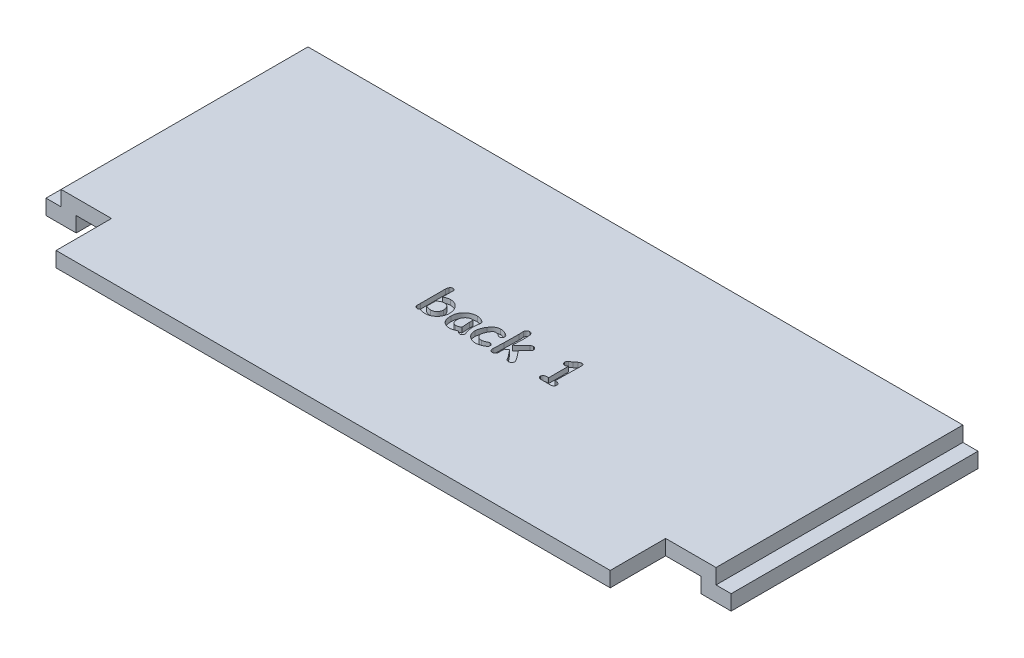
from build123d import *

# Parameters (mm, degrees)
SKETCH_1_W          = 110
SKETCH_1_H          = 3
EXTRUDE_1_DEPTH     = 11
SKETCH_2_W          = 136
SKETCH_2_H          = 3
EXTRUDE_2_DEPTH     = 14
SKETCH_3_W          = 136
SKETCH_3_H          = 6
EXTRUDE_3_DEPTH     = 3
SKETCH_4_W          = 130
SKETCH_4_H          = 3
EXTRUDE_4_DEPTH     = 32
SKETCH_10_W         = 6
SKETCH_10_H         = 14
EXTRUDE_6_DEPTH     = 3
SKETCH_11_W         = 3
SKETCH_11_H         = 17
CUT_EXTRUDE_2_DEPTH = 3
SKETCH_12_W         = 124
SKETCH_12_H         = 35.16497992
CUT_EXTRUDE_3_DEPTH = 3
CUT_EXTRUDE_4_DEPTH = 1


with BuildPart() as part:
    # 草圖1 → 填料-伸長1 (new body)
    with BuildSketch(Plane.XY):
        with Locations((-47.028571429, 0.492857143)):
            Rectangle(SKETCH_1_W, SKETCH_1_H)
    extrude(amount=EXTRUDE_1_DEPTH)

    # 草圖2 → 填料-伸長2 (add)
    with BuildSketch(Plane(origin=(0, 0, 0), x_dir=(-1, 0, 0), z_dir=(0, 0, -1))):
        with Locations((47.028571429, 0.492857143)):
            Rectangle(SKETCH_2_W, SKETCH_2_H)
    extrude(amount=EXTRUDE_2_DEPTH)

    # 草圖3 → 填料-伸長3 (add)
    with BuildSketch(Plane(origin=(0, 0, -14), x_dir=(-1, 0, 0), z_dir=(0, 0, -1))):
        with Locations((47.028571429, -1.007142857)):
            Rectangle(SKETCH_3_W, SKETCH_3_H)
    extrude(amount=EXTRUDE_3_DEPTH)

    # 草圖4 → 填料-伸長4 (add)
    with BuildSketch(Plane(origin=(0, 0, -17), x_dir=(-1, 0, 0), z_dir=(0, 0, -1))):
        Polygon((-20.971428571, -4.007142857), (115.028571429, -4.007142857), (115.028571429, -1.007142857), (112.028571429, -1.007142857), (-17.971428571, -1.007142857), (-20.971428571, -1.007142857), align=None)
        with Locations((47.028571429, 0.492857143)):
            Rectangle(SKETCH_4_W, SKETCH_4_H)
    extrude(amount=EXTRUDE_4_DEPTH)

    # 草圖10 → 填料-伸長6 (add)
    with BuildSketch(Plane.XZ.offset(1.007142857)):
        with Locations((17.971428571, -7)):
            Rectangle(SKETCH_10_W, SKETCH_10_H)
        with Locations((-112.028571429, -7)):
            Rectangle(SKETCH_10_W, SKETCH_10_H)
    extrude(amount=EXTRUDE_6_DEPTH)

    # 草圖11 → 除料-伸長2 (cut)
    with BuildSketch(Plane(origin=(0, 1.992857143, 0), x_dir=(1, 0, 0), z_dir=(0, 1, 0))):
        with Locations((19.471428571, 8.5)):
            Rectangle(SKETCH_11_W, SKETCH_11_H)
        with Locations((-113.528571429, 8.5)):
            Rectangle(SKETCH_11_W, SKETCH_11_H)
    extrude(amount=-CUT_EXTRUDE_2_DEPTH, mode=Mode.SUBTRACT)

    # 草圖12 → 除料-伸長3 (cut)
    with BuildSketch(Plane.XZ.offset(4.007142857)):
        with Locations((-47.028571429, -31.58248996)):
            Rectangle(SKETCH_12_W, SKETCH_12_H)
    extrude(amount=-CUT_EXTRUDE_3_DEPTH, mode=Mode.SUBTRACT)

    # 草圖13 → 除料-伸長4 (cut)
    # profile 1 of 5: a face of its own
    with BuildSketch(Plane(origin=(0, 1.992857143, 0), x_dir=(1, 0, 0), z_dir=(0, 1, 0))):
        with BuildLine():
            add(Edge.make_bspline(
                [(-54.627504078, 14.779163289), (-54.730011786, 14.782196796), (-54.933438462, 14.788216796), (-55.234530646, 14.835959796), (-55.528768994, 14.911104097), (-55.715946121, 14.987694926), (-55.80967424, 15.026047444)],
                knots=[0, 0, 0, 0, 1.011051074, 2.006432122, 3.001729703, 4, 4, 4, 4], degree=3))
            add(Edge.make_bspline(
                [(-55.80967424, 15.026047444), (-55.837443409, 15.000782814), (-55.891964228, 14.951179301), (-55.990120587, 14.899833319), (-56.096887174, 14.86862703), (-56.171290167, 14.864749784), (-56.209391443, 14.862764273)],
                knots=[0, 0, 0, 0, 1.012867807, 1.988622055, 2.969986786, 4, 4, 4, 4], degree=3))
            add(Edge.make_bspline(
                [(-56.209391443, 14.862764273), (-56.248304907, 14.864900742), (-56.324190104, 14.869067073), (-56.433967072, 14.898024094), (-56.533184481, 14.949614537), (-56.623142226, 15.016472937), (-56.697846378, 15.099830557), (-56.752135306, 15.195621847), (-56.786898101, 15.301508337), (-56.790260236, 15.375852357), (-56.791985799, 15.41400826)],
                knots=[0, 0, 0, 0, 1.045861851, 2.039536594, 3.023583619, 4.034817863, 5.037891374, 6.007635444, 6.977450141, 8, 8, 8, 8], degree=3))
            add(Edge.make_bspline(
                [(-56.791985799, 15.41400826), (-56.791600254, 15.433603571), (-56.790726172, 15.478028755), (-56.788019166, 15.551182492), (-56.784036056, 15.638701522), (-56.77871026, 15.735339787), (-56.774576716, 15.832490843), (-56.767616764, 15.919884394), (-56.767502197, 15.993129143), (-56.766366514, 16.037099237), (-56.765860492, 16.056690823)],
                knots=[0, 0, 0, 0, 0.731206305, 1.657742177, 2.731020434, 3.999796929, 5.268573424, 6.358927633, 7.268793695, 8, 8, 8, 8], degree=3))
            Line((-56.765860492, 16.056690823), (-56.765860492, 21.013967909))
            add(Edge.make_bspline(
                [(-56.765860492, 21.013967909), (-56.764123656, 21.06547242), (-56.760744079, 21.165691116), (-56.733779842, 21.31149316), (-56.69018187, 21.448615125), (-56.646473855, 21.532652404), (-56.624783832, 21.574355753)],
                knots=[0, 0, 0, 0, 1.05727785, 2.057276263, 3.035926844, 4, 4, 4, 4], degree=3))
            add(Edge.make_bspline(
                [(-56.624783832, 21.574355753), (-56.609667828, 21.599120298), (-56.580509053, 21.646891112), (-56.528729708, 21.710543575), (-56.472234945, 21.764697555), (-56.41083668, 21.809344024), (-56.344848936, 21.843893915), (-56.274241416, 21.867416391), (-56.199117605, 21.882185711), (-56.147196625, 21.884209085), (-56.120565398, 21.885246912)],
                knots=[0, 0, 0, 0, 1.115704314, 2.152193933, 3.147912463, 4.120081468, 5.06455433, 6.002611774, 6.975502777, 8, 8, 8, 8], degree=3))
            add(Edge.make_bspline(
                [(-56.120565398, 21.885246912), (-56.083401008, 21.883990212), (-56.01344459, 21.881624662), (-55.915396963, 21.857548169), (-55.831360492, 21.818773995), (-55.761744488, 21.76223584), (-55.710626278, 21.687798388), (-55.673515192, 21.598950963), (-55.651918387, 21.494811697), (-55.649154938, 21.420319856), (-55.647697333, 21.381028478)],
                knots=[0, 0, 0, 0, 1.124217311, 2.116171334, 3.036773383, 3.908427477, 4.797970107, 5.743844808, 6.809971068, 8, 8, 8, 8], degree=3))
            add(Edge.make_bspline(
                [(-55.647697333, 21.381028478), (-55.648728843, 21.356622438), (-55.651277673, 21.296315851), (-55.663372518, 21.200763857), (-55.675467363, 21.105211863), (-55.678016192, 21.044905276), (-55.679047702, 21.020499235)],
                knots=[0, 0, 0, 0, 0.809398822, 2, 3.190601178, 4, 4, 4, 4], degree=3))
            Line((-55.679047702, 21.020499235), (-55.679047702, 19.349785825))
            add(Edge.make_bspline(
                [(-55.679047702, 19.349785825), (-55.624836559, 19.37850178), (-55.518811889, 19.434663659), (-55.359551153, 19.510127916), (-55.202293553, 19.570751111), (-55.049263096, 19.622835936), (-54.898491166, 19.661749746), (-54.751172082, 19.690851624), (-54.606181914, 19.708825914), (-54.510424711, 19.71069432), (-54.462914641, 19.711621333)],
                knots=[0, 0, 0, 0, 1.148291504, 2.245797059, 3.296170274, 4.301333296, 5.269981604, 6.20825412, 7.111022791, 8, 8, 8, 8], degree=3))
            add(Edge.make_bspline(
                [(-54.462914641, 19.711621333), (-54.377447098, 19.709465036), (-54.210108789, 19.705243187), (-53.965753786, 19.669170544), (-53.734113963, 19.610290775), (-53.514354226, 19.528322721), (-53.308434219, 19.419528459), (-53.11343988, 19.289969465), (-52.932202223, 19.135160068), (-52.824499848, 19.0165999), (-52.769994719, 18.956599948)],
                knots=[0, 0, 0, 0, 1.069904979, 2.094784584, 3.085377722, 4.058664938, 5.024515174, 5.995462442, 6.985560174, 8, 8, 8, 8], degree=3))
            add(Edge.make_bspline(
                [(-52.769994719, 18.956599948), (-52.721841815, 18.896913822), (-52.626187687, 18.778349336), (-52.503347175, 18.586601889), (-52.399867223, 18.385643511), (-52.314004477, 18.17567298), (-52.249169249, 17.955331784), (-52.202386887, 17.725927391), (-52.172494402, 17.487404252), (-52.169385208, 17.325164113), (-52.167806383, 17.24277978)],
                knots=[0, 0, 0, 0, 0.991022406, 1.968632743, 2.938070816, 3.910365585, 4.89720526, 5.903084783, 6.935202082, 8, 8, 8, 8], degree=3))
            add(Edge.make_bspline(
                [(-52.167806383, 17.24277978), (-52.169674144, 17.159075261), (-52.173356353, 16.994055416), (-52.206690191, 16.751583448), (-52.26212134, 16.519147803), (-52.336982062, 16.295503819), (-52.438242856, 16.083656658), (-52.556662144, 15.879327016), (-52.70009099, 15.686528145), (-52.809803293, 15.568047629), (-52.865352091, 15.508059366)],
                knots=[0, 0, 0, 0, 1.045981923, 2.062108186, 3.052288653, 4.029988146, 5.003983643, 5.982319294, 6.978421401, 8, 8, 8, 8], degree=3))
            add(Edge.make_bspline(
                [(-52.865352091, 15.508059366), (-52.925066102, 15.449591339), (-53.043021323, 15.334097352), (-53.239647721, 15.187542112), (-53.444013692, 15.059701279), (-53.661070614, 14.959018693), (-53.886713707, 14.875722996), (-54.124692171, 14.821097983), (-54.372594686, 14.785829872), (-54.541601298, 14.781409883), (-54.627504078, 14.779163289)],
                knots=[0, 0, 0, 0, 1.021703276, 2.018207041, 2.994298099, 3.966848069, 4.941133761, 5.932494983, 6.949127326, 8, 8, 8, 8], degree=3))
        make_face()
        with BuildLine():
            add(Edge.make_bspline(
                [(-54.464220907, 18.54120756), (-54.50439418, 18.5396531), (-54.588493017, 18.536398989), (-54.717938384, 18.509497806), (-54.856182144, 18.46826704), (-55.003330466, 18.411922263), (-55.159783591, 18.339103727), (-55.325060579, 18.249848141), (-55.500321029, 18.145316026), (-55.61798565, 18.067119229), (-55.679047702, 18.026539003)],
                knots=[0, 0, 0, 0, 0.721005008, 1.509353813, 2.36553554, 3.311060063, 4.336278061, 5.462876802, 6.683359988, 8, 8, 8, 8], degree=3))
            add(Edge.make_bspline(
                [(-55.679047702, 18.026539003), (-55.679586142, 17.987351614), (-55.680806562, 17.89852993), (-55.680188977, 17.749174407), (-55.680411071, 17.568475591), (-55.680331682, 17.355989348), (-55.680376174, 17.112588667), (-55.680280281, 16.837402221), (-55.680669979, 16.530863706), (-55.679605698, 16.315766553), (-55.679047702, 16.202992544)],
                knots=[0, 0, 0, 0, 0.515788382, 1.169080008, 1.965637341, 2.893999125, 3.965626617, 5.169058559, 6.515756208, 8, 8, 8, 8], degree=3))
            add(Edge.make_bspline(
                [(-55.679047702, 16.202992544), (-55.629047166, 16.183217752), (-55.531655177, 16.144700039), (-55.387708907, 16.091267891), (-55.248312929, 16.048732034), (-55.114439559, 16.013506154), (-54.98666181, 15.983705881), (-54.863930411, 15.964671042), (-54.746644255, 15.951915245), (-54.67020702, 15.95034632), (-54.63272914, 15.949577062)],
                knots=[0, 0, 0, 0, 1.191481398, 2.320789979, 3.401144957, 4.419169971, 5.388239374, 6.306657422, 7.169738545, 8, 8, 8, 8], degree=3))
            add(Edge.make_bspline(
                [(-54.63272914, 15.949577062), (-54.586501345, 15.950274334), (-54.49626843, 15.951635353), (-54.364346792, 15.971259815), (-54.238561108, 15.999966162), (-54.117751777, 16.037975468), (-54.004890784, 16.091885448), (-53.89701999, 16.154129806), (-53.795955233, 16.229236691), (-53.702406321, 16.315531428), (-53.616843525, 16.409774389), (-53.542042496, 16.510848277), (-53.478009659, 16.617645851), (-53.428274463, 16.731416446), (-53.386328997, 16.850267775), (-53.358421376, 16.975679714), (-53.340784236, 17.106856149), (-53.339083799, 17.196131208), (-53.338220156, 17.241473515)],
                knots=[0, 0, 0, 0, 1.082436338, 2.112828187, 3.117845096, 4.105302121, 5.073161415, 6.042740585, 7.020341339, 8.017034983, 9.021274517, 9.998875271, 10.959661725, 11.932564502, 12.903914104, 13.908931013, 14.937957669, 16, 16, 16, 16], degree=3))
            add(Edge.make_bspline(
                [(-53.338220156, 17.241473515), (-53.339443856, 17.286779121), (-53.341849185, 17.375832739), (-53.354233063, 17.506605386), (-53.378275797, 17.631418037), (-53.410577961, 17.750387593), (-53.452495098, 17.863218705), (-53.503752674, 17.970105788), (-53.564945078, 18.070539142), (-53.61241859, 18.132737477), (-53.636048661, 18.163696867)],
                knots=[0, 0, 0, 0, 1.100015173, 2.162212091, 3.184155695, 4.181593202, 5.15143388, 6.10160926, 7.055070829, 8, 8, 8, 8], degree=3))
            add(Edge.make_bspline(
                [(-53.636048661, 18.163696867), (-53.662298885, 18.19403961), (-53.713828139, 18.253602487), (-53.803170428, 18.329465613), (-53.897231417, 18.395396239), (-53.99827614, 18.449718864), (-54.106392638, 18.489319106), (-54.219736285, 18.520693115), (-54.340103916, 18.53680292), (-54.422381981, 18.539722788), (-54.464220907, 18.54120756)],
                knots=[0, 0, 0, 0, 1.020672895, 2.003583353, 2.975859956, 3.943443527, 4.915783394, 5.903189464, 6.933758352, 8, 8, 8, 8], degree=3))
        make_face(mode=Mode.SUBTRACT)
    # profile 2 of 5: a face of its own
    with BuildSketch(Plane(origin=(0, 1.992857143, 0), x_dir=(1, 0, 0), z_dir=(0, 1, 0))):
        with BuildLine():
            add(Edge.make_bspline(
                [(-47.648128196, 14.695562305), (-47.666104091, 14.697086433), (-47.705006405, 14.700384857), (-47.765813302, 14.720792175), (-47.834145456, 14.751089084), (-47.909747348, 14.794601278), (-47.991341946, 14.851828309), (-48.082262286, 14.918389292), (-48.180002559, 14.998071941), (-48.245799902, 15.057521622), (-48.280360636, 15.088748182)],
                knots=[0, 0, 0, 0, 0.570994106, 1.235709944, 2.021750519, 2.944254947, 3.998712181, 5.184863288, 6.52132032, 8, 8, 8, 8], degree=3))
            add(Edge.make_bspline(
                [(-48.280360636, 15.088748182), (-48.344636904, 15.057916146), (-48.468508322, 14.998497512), (-48.649504787, 14.91861006), (-48.819295159, 14.851892623), (-48.976465329, 14.794783729), (-49.122808261, 14.752027213), (-49.257212858, 14.719253101), (-49.380569515, 14.700369889), (-49.459430796, 14.69709937), (-49.496493698, 14.695562305)],
                knots=[0, 0, 0, 0, 1.329209789, 2.561615814, 3.687824394, 4.730391586, 5.678350345, 6.529086513, 7.308706092, 8, 8, 8, 8], degree=3))
            add(Edge.make_bspline(
                [(-49.496493698, 14.695562305), (-49.580601319, 14.697322288), (-49.744015004, 14.700741779), (-49.981326617, 14.727019137), (-50.20250138, 14.770299528), (-50.406925973, 14.834081281), (-50.596147533, 14.912702041), (-50.768355862, 15.011910116), (-50.92546338, 15.12691699), (-51.064962669, 15.261857232), (-51.188161313, 15.414079715), (-51.294875355, 15.584169622), (-51.383191779, 15.772333024), (-51.456463121, 15.977501543), (-51.513793997, 16.200024578), (-51.553294017, 16.44046489), (-51.578829964, 16.697950071), (-51.581318242, 16.875654768), (-51.582599496, 16.967157787)],
                knots=[0, 0, 0, 0, 1.14139066, 2.217621297, 3.236433233, 4.19541141, 5.119669229, 6.01179398, 6.886502125, 7.755903195, 8.638304332, 9.538535932, 10.474361038, 11.453933755, 12.49175023, 13.588698518, 14.758381922, 16, 16, 16, 16], degree=3))
            add(Edge.make_bspline(
                [(-51.582599496, 16.967157787), (-51.580514118, 17.054373126), (-51.576407647, 17.226115291), (-51.538658447, 17.478748852), (-51.477009561, 17.721493162), (-51.391967348, 17.955579508), (-51.28156015, 18.179506293), (-51.14721952, 18.393955535), (-50.98849425, 18.598435594), (-50.806263996, 18.789694357), (-50.608715275, 18.96585822), (-50.399386072, 19.121213699), (-50.179222319, 19.25115498), (-49.950831893, 19.358958784), (-49.711524742, 19.441608944), (-49.463665725, 19.501749362), (-49.20538955, 19.537885599), (-49.030272034, 19.54221864), (-48.941330915, 19.544419365)],
                knots=[0, 0, 0, 0, 1.020575022, 2.009689629, 2.982726031, 3.948726453, 4.919931715, 5.900139181, 6.906560586, 7.945094392, 8.988633149, 10.002091967, 10.991758148, 11.976937157, 12.953918173, 13.950466294, 14.959054324, 16, 16, 16, 16], degree=3))
            add(Edge.make_bspline(
                [(-48.941330915, 19.544419365), (-48.869285737, 19.541475166), (-48.718289204, 19.535304539), (-48.485026664, 19.487364357), (-48.235627312, 19.412467221), (-48.067772217, 19.343881815), (-47.979919601, 19.307985333)],
                knots=[0, 0, 0, 0, 0.867176249, 1.817479126, 2.857704205, 4, 4, 4, 4], degree=3))
            add(Edge.make_bspline(
                [(-47.979919601, 19.307985333), (-47.927637146, 19.28498816), (-47.828559201, 19.241407333), (-47.69450902, 19.16468247), (-47.579976284, 19.086603867), (-47.484765164, 19.00645378), (-47.411070381, 18.921984651), (-47.358768476, 18.834041022), (-47.32506018, 18.742575827), (-47.320971132, 18.679505913), (-47.318949323, 18.64832132)],
                knots=[0, 0, 0, 0, 1.389672819, 2.63350156, 3.753796321, 4.761008421, 5.655539949, 6.468188948, 7.242603956, 8, 8, 8, 8], degree=3))
            add(Edge.make_bspline(
                [(-47.318949323, 18.64832132), (-47.319751503, 18.622944901), (-47.321320057, 18.573324745), (-47.339654526, 18.501707958), (-47.366360137, 18.434162389), (-47.393093597, 18.394066634), (-47.406469103, 18.374005592)],
                knots=[0, 0, 0, 0, 1.037888639, 2.029450906, 3.014078523, 4, 4, 4, 4], degree=3))
            add(Edge.make_bspline(
                [(-47.406469103, 18.374005592), (-47.412857586, 18.343144099), (-47.426387384, 18.277784339), (-47.441586029, 18.17309146), (-47.454084723, 18.057124877), (-47.466196717, 17.93045678), (-47.475121162, 17.792802445), (-47.481538274, 17.643854221), (-47.485456502, 17.483589062), (-47.485914902, 17.372973163), (-47.48615129, 17.315930641)],
                knots=[0, 0, 0, 0, 0.711555323, 1.50696163, 2.387567636, 3.345424226, 4.380136604, 5.502128072, 6.711894799, 8, 8, 8, 8], degree=3))
            add(Edge.make_bspline(
                [(-47.48615129, 17.315930641), (-47.486040947, 17.248871488), (-47.485828103, 17.119520079), (-47.480290894, 16.933133777), (-47.472438806, 16.761125385), (-47.462806101, 16.603785385), (-47.448018296, 16.460973995), (-47.431736611, 16.332718906), (-47.411154583, 16.218905654), (-47.393736421, 16.148490969), (-47.385568857, 16.115472764)],
                knots=[0, 0, 0, 0, 1.332734974, 2.570732545, 3.705587252, 4.755000234, 5.703070943, 6.558586414, 7.32410562, 8, 8, 8, 8], degree=3))
            add(Edge.make_bspline(
                [(-47.385568857, 16.115472764), (-47.383873346, 16.110231154), (-47.37916562, 16.095677385), (-47.368135202, 16.068613663), (-47.354380214, 16.029036133), (-47.334151481, 15.978493548), (-47.311221868, 15.91540696), (-47.281923281, 15.841329006), (-47.249744049, 15.754766757), (-47.225861141, 15.693513854), (-47.213141828, 15.660892415)],
                knots=[0, 0, 0, 0, 0.271870762, 0.754871954, 1.441648389, 2.339748258, 3.441579783, 4.754781702, 6.27169509, 8, 8, 8, 8], degree=3))
            add(Edge.make_bspline(
                [(-47.213141828, 15.660892415), (-47.201866879, 15.631266274), (-47.180640189, 15.57549086), (-47.150003388, 15.497065159), (-47.125307558, 15.428200082), (-47.105795787, 15.369234812), (-47.090252365, 15.320861676), (-47.077731035, 15.282883124), (-47.070985051, 15.254401819), (-47.068935923, 15.238546574), (-47.068146371, 15.232437373)],
                knots=[0, 0, 0, 0, 1.679572054, 3.162032608, 4.460976333, 5.555315553, 6.45270337, 7.153232445, 7.673731082, 8, 8, 8, 8], degree=3))
            add(Edge.make_bspline(
                [(-47.068146371, 15.232437373), (-47.069888876, 15.19515289), (-47.073283697, 15.122513689), (-47.107896728, 15.018869332), (-47.163784931, 14.925420299), (-47.241464616, 14.845607707), (-47.331671358, 14.780228716), (-47.430341823, 14.729800333), (-47.53717138, 14.700522661), (-47.610945936, 14.697224549), (-47.648128196, 14.695562305)],
                knots=[0, 0, 0, 0, 1.016199693, 1.979803046, 2.951459139, 3.970165221, 5.001037038, 5.985800237, 6.984846462, 8, 8, 8, 8], degree=3))
        make_face()
        with BuildLine():
            add(Edge.make_bspline(
                [(-48.656565063, 17.662090964), (-48.656565063, 17.711293627), (-48.656565063, 17.8166657), (-48.656565063, 17.985173933), (-48.656565063, 18.173711568), (-48.656565063, 18.306079793), (-48.656565063, 18.375311858)],
                knots=[0, 0, 0, 0, 0.827838828, 1.772893773, 2.835164835, 4, 4, 4, 4], degree=3))
            add(Edge.make_bspline(
                [(-48.656565063, 18.375311858), (-48.682403327, 18.38860662), (-48.730071532, 18.413133713), (-48.79973629, 18.437518445), (-48.859625751, 18.453619546), (-48.896840866, 18.456353431), (-48.913899342, 18.457606576)],
                knots=[0, 0, 0, 0, 1.278646011, 2.358934062, 3.247776538, 4, 4, 4, 4], degree=3))
            add(Edge.make_bspline(
                [(-48.913899342, 18.457606576), (-48.960600183, 18.456654279), (-49.05281457, 18.454773897), (-49.188259112, 18.430630237), (-49.31986135, 18.396650278), (-49.44571771, 18.34416527), (-49.568059615, 18.280053819), (-49.686428778, 18.201511984), (-49.798298445, 18.106196835), (-49.905741428, 18.000494161), (-50.004327556, 17.885282473), (-50.090652996, 17.763588315), (-50.164504683, 17.637462305), (-50.225079481, 17.506840355), (-50.270245994, 17.371136362), (-50.305243701, 17.232069049), (-50.324839706, 17.08746072), (-50.327325019, 16.989419834), (-50.328584739, 16.939726214)],
                knots=[0, 0, 0, 0, 0.975911698, 1.927012402, 2.870709727, 3.814758816, 4.772469297, 5.757945252, 6.779810011, 7.842802078, 8.909068736, 9.948051348, 10.960613622, 11.963456129, 12.954559341, 13.948923457, 14.960378456, 16, 16, 16, 16], degree=3))
            add(Edge.make_bspline(
                [(-50.328584739, 16.939726214), (-50.328379551, 16.893107645), (-50.327982018, 16.802788755), (-50.316519044, 16.67208719), (-50.301730222, 16.550246371), (-50.279325914, 16.437223307), (-50.251167742, 16.332618959), (-50.215492127, 16.237226308), (-50.175771772, 16.149626654), (-50.126712556, 16.072862594), (-50.073300728, 16.003272395), (-50.011315465, 15.944913215), (-49.944223331, 15.894154345), (-49.869941889, 15.853906472), (-49.790584236, 15.820545437), (-49.703745764, 15.799104936), (-49.611557342, 15.783766593), (-49.547506991, 15.782845641), (-49.514781413, 15.782375094)],
                knots=[0, 0, 0, 0, 1.390925397, 2.694781069, 3.913525777, 5.052899351, 6.131261505, 7.142861553, 8.090576077, 8.995714656, 9.856369476, 10.702075908, 11.528691265, 12.360602882, 13.21742184, 14.090644474, 15.024443049, 16, 16, 16, 16], degree=3))
            add(Edge.make_bspline(
                [(-49.514781413, 15.782375094), (-49.471178429, 15.783235228), (-49.384936498, 15.784936477), (-49.257791805, 15.802845755), (-49.134531322, 15.830117854), (-49.014545204, 15.86814343), (-48.898437735, 15.918045385), (-48.785728897, 15.978397722), (-48.676499577, 16.049266352), (-48.607815837, 16.103585252), (-48.57296408, 16.131147949)],
                knots=[0, 0, 0, 0, 1.019791921, 2.017036824, 2.998486841, 3.971703296, 4.957797258, 5.951600318, 6.960593445, 8, 8, 8, 8], degree=3))
            add(Edge.make_bspline(
                [(-48.57296408, 16.131147949), (-48.579588645, 16.213870847), (-48.592381944, 16.373624548), (-48.609411155, 16.60527012), (-48.623854188, 16.8208047), (-48.635617779, 17.020233883), (-48.644906223, 17.203548753), (-48.651466213, 17.370759424), (-48.65567675, 17.521863445), (-48.656280943, 17.617240219), (-48.656565063, 17.662090964)],
                knots=[0, 0, 0, 0, 1.298731023, 2.508097406, 3.634940138, 4.679318611, 5.63450171, 6.507387574, 7.298101854, 8, 8, 8, 8], degree=3))
        make_face(mode=Mode.SUBTRACT)
    # profile 3 of 5: a face of its own
    with BuildSketch(Plane(origin=(0, 1.992857143, 0), x_dir=(1, 0, 0), z_dir=(0, 1, 0))):
        with BuildLine():
            add(Edge.make_bspline(
                [(-44.368095848, 14.695562305), (-44.446095658, 14.697488643), (-44.599010542, 14.701265136), (-44.823756071, 14.725933149), (-45.038694465, 14.769264483), (-45.244602592, 14.829403921), (-45.441182856, 14.906300485), (-45.627554648, 15.001344211), (-45.805185815, 15.111660309), (-45.913809123, 15.199064554), (-45.968270928, 15.242887496)],
                knots=[0, 0, 0, 0, 1.083691855, 2.124525873, 3.136533083, 4.126235372, 5.101334756, 6.064482253, 7.02956565, 8, 8, 8, 8], degree=3))
            add(Edge.make_bspline(
                [(-45.968270928, 15.242887496), (-46.022574168, 15.291782649), (-46.129714851, 15.388253137), (-46.268368276, 15.55199933), (-46.386988685, 15.725923998), (-46.482802279, 15.912703092), (-46.559646291, 16.109752439), (-46.610301774, 16.319456839), (-46.645081087, 16.539285055), (-46.648427842, 16.690085917), (-46.650141452, 16.767299185)],
                knots=[0, 0, 0, 0, 1.014639395, 2.001890845, 2.973756588, 3.934650509, 4.913575447, 5.90580403, 6.927726846, 8, 8, 8, 8], degree=3))
            add(Edge.make_bspline(
                [(-46.650141452, 16.767299185), (-46.648440735, 16.840538929), (-46.645016238, 16.988011596), (-46.615024625, 17.209628534), (-46.56590976, 17.432502034), (-46.499871109, 17.657360837), (-46.41174328, 17.883091554), (-46.30805235, 18.111489838), (-46.183094396, 18.341209032), (-46.08762842, 18.490823421), (-46.038809258, 18.567332867)],
                knots=[0, 0, 0, 0, 0.91128532, 1.834928266, 2.777832236, 3.750120815, 4.748566274, 5.791402145, 6.870572541, 8, 8, 8, 8], degree=3))
            add(Edge.make_bspline(
                [(-46.038809258, 18.567332867), (-45.981073434, 18.651177703), (-45.869708192, 18.812903987), (-45.684402996, 19.02918862), (-45.493914273, 19.214625864), (-45.293897086, 19.364619475), (-45.087473941, 19.483533224), (-44.872325939, 19.56592878), (-44.650555048, 19.618138205), (-44.499875874, 19.62471841), (-44.424265259, 19.628020349)],
                knots=[0, 0, 0, 0, 1.21071845, 2.335325656, 3.383441613, 4.367943037, 5.303072257, 6.208560974, 7.101058217, 8, 8, 8, 8], degree=3))
            add(Edge.make_bspline(
                [(-44.424265259, 19.628020349), (-44.34569698, 19.624634291), (-44.181273074, 19.617548111), (-43.926248455, 19.568324433), (-43.652427515, 19.490924356), (-43.467111867, 19.419716131), (-43.370109104, 19.382442459)],
                knots=[0, 0, 0, 0, 0.866018151, 1.812361022, 2.854888801, 4, 4, 4, 4], degree=3))
            add(Edge.make_bspline(
                [(-43.370109104, 19.382442459), (-43.312714767, 19.35752334), (-43.203670192, 19.310179038), (-43.053668646, 19.230778614), (-42.927009185, 19.147463712), (-42.821295738, 19.062996652), (-42.740377981, 18.973206528), (-42.680627343, 18.880815936), (-42.644770068, 18.783640934), (-42.639753769, 18.717383431), (-42.63729423, 18.684896751)],
                knots=[0, 0, 0, 0, 1.405890222, 2.671077145, 3.8082404, 4.809313724, 5.703213223, 6.512265436, 7.270549675, 8, 8, 8, 8], degree=3))
            add(Edge.make_bspline(
                [(-42.63729423, 18.684896751), (-42.638916933, 18.649840145), (-42.642113415, 18.580783856), (-42.671748219, 18.481248073), (-42.715344435, 18.38600911), (-42.759655195, 18.331375033), (-42.782289686, 18.303467262)],
                knots=[0, 0, 0, 0, 1.006613563, 1.982878726, 2.969629185, 4, 4, 4, 4], degree=3))
            add(Edge.make_bspline(
                [(-42.782289686, 18.303467262), (-42.808561921, 18.275945919), (-42.860159074, 18.221895589), (-42.957539895, 18.165130871), (-43.065506073, 18.129688777), (-43.141664842, 18.125400587), (-43.180700625, 18.123202641)],
                knots=[0, 0, 0, 0, 1.00756414, 1.978797873, 2.964016776, 4, 4, 4, 4], degree=3))
            add(Edge.make_bspline(
                [(-43.180700625, 18.123202641), (-43.213269857, 18.126019918), (-43.283104642, 18.132060709), (-43.389603541, 18.176667147), (-43.50602808, 18.241340787), (-43.603670065, 18.31857962), (-43.690626701, 18.383929479), (-43.768506346, 18.42554737), (-43.852884702, 18.462633341), (-43.947054837, 18.490465526), (-44.048052316, 18.514579673), (-44.157915693, 18.529102738), (-44.275107406, 18.540608279), (-44.356306265, 18.541003792), (-44.398139951, 18.54120756)],
                knots=[0, 0, 0, 0, 0.889797914, 1.907900243, 3.124323455, 4.530460347, 5.307561749, 6.096900293, 6.940245763, 7.825965133, 8.779839662, 9.779149838, 10.855817078, 12, 12, 12, 12], degree=3))
            add(Edge.make_bspline(
                [(-44.398139951, 18.54120756), (-44.426275014, 18.539061227), (-44.48463513, 18.534609122), (-44.571204007, 18.500374797), (-44.657776021, 18.446376219), (-44.747511298, 18.373707153), (-44.837047978, 18.278385626), (-44.927720981, 18.162461808), (-45.022817877, 18.02763955), (-45.081627941, 17.927738608), (-45.11266711, 17.87501222)],
                knots=[0, 0, 0, 0, 0.66431097, 1.377969749, 2.172850726, 3.073648054, 4.100782166, 5.258938009, 6.553303951, 8, 8, 8, 8], degree=3))
            add(Edge.make_bspline(
                [(-45.11266711, 17.87501222), (-45.141906558, 17.822594103), (-45.198755456, 17.720680002), (-45.273354894, 17.567644003), (-45.335955505, 17.419616596), (-45.389077264, 17.278009472), (-45.428247776, 17.141074039), (-45.456988399, 17.010236551), (-45.477147038, 16.884615424), (-45.478882543, 16.802205276), (-45.479727679, 16.762074123)],
                knots=[0, 0, 0, 0, 1.2162467, 2.364691771, 3.448067279, 4.472633935, 5.427777921, 6.331308114, 7.187399491, 8, 8, 8, 8], degree=3))
            add(Edge.make_bspline(
                [(-45.479727679, 16.762074123), (-45.478794015, 16.724564226), (-45.476961602, 16.65094717), (-45.460549402, 16.543855984), (-45.436353542, 16.442441298), (-45.400801048, 16.347693824), (-45.354897029, 16.259387987), (-45.297767237, 16.177794836), (-45.231441535, 16.101638523), (-45.180271733, 16.056996557), (-45.154467602, 16.034484311)],
                knots=[0, 0, 0, 0, 1.089755579, 2.138758116, 3.14264948, 4.115991192, 5.072813988, 6.027876915, 7.005489131, 8, 8, 8, 8], degree=3))
            add(Edge.make_bspline(
                [(-45.154467602, 16.034484311), (-45.128326999, 16.014273208), (-45.075749491, 15.97362191), (-44.988293392, 15.923338054), (-44.895878284, 15.87806507), (-44.796065111, 15.843518816), (-44.691265154, 15.815920957), (-44.580312527, 15.796333041), (-44.463275947, 15.784544826), (-44.382928124, 15.783107683), (-44.34197054, 15.782375094)],
                knots=[0, 0, 0, 0, 0.912766912, 1.835880032, 2.783791605, 3.754973837, 4.750922317, 5.778400463, 6.86753185, 8, 8, 8, 8], degree=3))
            add(Edge.make_bspline(
                [(-44.34197054, 15.782375094), (-44.291248313, 15.785194061), (-44.183252461, 15.791196098), (-44.01473443, 15.83430005), (-43.830607783, 15.899639019), (-43.672209313, 15.974623541), (-43.545396249, 16.039807145), (-43.455198481, 16.081448661), (-43.375651418, 16.11856773), (-43.304360012, 16.146303873), (-43.244354089, 16.171876941), (-43.192196133, 16.185969597), (-43.150380637, 16.198805575), (-43.125030546, 16.199905097), (-43.114081091, 16.200380013)],
                knots=[0, 0, 0, 0, 1.39642188, 2.973208746, 4.767490367, 6.774552881, 7.793659128, 8.695018978, 9.510938905, 10.210282052, 10.802723968, 11.303592913, 11.699201139, 12, 12, 12, 12], degree=3))
            add(Edge.make_bspline(
                [(-43.114081091, 16.200380013), (-43.076830128, 16.198475696), (-43.003554483, 16.194729749), (-42.898128191, 16.161711708), (-42.801056549, 16.108767928), (-42.716258917, 16.035479473), (-42.645363982, 15.950607318), (-42.590868508, 15.858124821), (-42.560014153, 15.757724519), (-42.55580871, 15.688954483), (-42.553693246, 15.654361088)],
                knots=[0, 0, 0, 0, 1.031535782, 2.029114027, 3.034853748, 4.080655119, 5.118680386, 6.092788141, 7.040615124, 8, 8, 8, 8], degree=3))
            add(Edge.make_bspline(
                [(-42.553693246, 15.654361088), (-42.55612415, 15.626153045), (-42.561118526, 15.568198659), (-42.598896382, 15.483191385), (-42.657288858, 15.399114447), (-42.741035752, 15.316769247), (-42.84599862, 15.233770083), (-42.973464357, 15.149995957), (-43.124677683, 15.068611788), (-43.234005525, 15.016819535), (-43.291733181, 14.989472014)],
                knots=[0, 0, 0, 0, 0.650096192, 1.335644785, 2.116869638, 3.005977185, 4.036499252, 5.205440487, 6.524407232, 8, 8, 8, 8], degree=3))
            add(Edge.make_bspline(
                [(-43.291733181, 14.989472014), (-43.345067275, 14.965854955), (-43.448691715, 14.919968649), (-43.6032158, 14.862067414), (-43.748912575, 14.810944589), (-43.887023677, 14.767600905), (-44.018375259, 14.737602106), (-44.141354176, 14.712575884), (-44.257220181, 14.699539477), (-44.331930844, 14.696859564), (-44.368095848, 14.695562305)],
                knots=[0, 0, 0, 0, 1.246221476, 2.421321812, 3.524836427, 4.5462079, 5.512163496, 6.402708677, 7.226803174, 8, 8, 8, 8], degree=3))
        make_face()
    # profile 4 of 5: a face of its own
    with BuildSketch(Plane(origin=(0, 1.992857143, 0), x_dir=(1, 0, 0), z_dir=(0, 1, 0))):
        with BuildLine():
            add(Edge.make_bspline(
                [(-38.019646141, 14.779163289), (-38.048451169, 14.780199611), (-38.104687715, 14.782222841), (-38.186250498, 14.79705784), (-38.263065689, 14.820142267), (-38.333951371, 14.854821666), (-38.400274621, 14.8981872), (-38.46034969, 14.952079601), (-38.514449306, 15.01590952), (-38.54568235, 15.063146685), (-38.56174627, 15.087441917)],
                knots=[0, 0, 0, 0, 1.055284525, 2.060249876, 3.029475638, 3.986003571, 4.942131979, 5.925576333, 6.933073087, 8, 8, 8, 8], degree=3))
            add(Edge.make_bspline(
                [(-38.56174627, 15.087441917), (-38.6023, 15.158046015), (-38.688219862, 15.307632607), (-38.842288322, 15.534868042), (-39.021791929, 15.78137827), (-39.155393035, 15.948373659), (-39.225329079, 16.035790577)],
                knots=[0, 0, 0, 0, 0.842872345, 1.785766055, 2.840917054, 4, 4, 4, 4], degree=3))
            add(Edge.make_bspline(
                [(-39.225329079, 16.035790577), (-39.279366133, 16.102373939), (-39.380626047, 16.227144354), (-39.521635524, 16.402239189), (-39.642516232, 16.552681294), (-39.74161199, 16.679275477), (-39.823851021, 16.778853746), (-39.884692985, 16.854268497), (-39.92569807, 16.904829225), (-39.945122283, 16.930986206), (-39.951612626, 16.939726214)],
                knots=[0, 0, 0, 0, 1.774793462, 3.325781504, 4.652979406, 5.769072161, 6.652972821, 7.325733258, 7.774702729, 8, 8, 8, 8], degree=3))
            add(Edge.make_bspline(
                [(-39.951612626, 16.939726214), (-40.008810639, 16.898393964), (-40.11711085, 16.820134402), (-40.275275496, 16.715062985), (-40.414753819, 16.621047924), (-40.505232431, 16.567500276), (-40.547269635, 16.542621541)],
                knots=[0, 0, 0, 0, 1.182330947, 2.238656279, 3.181663322, 4, 4, 4, 4], degree=3))
            add(Edge.make_bspline(
                [(-40.547269635, 16.542621541), (-40.560006344, 16.342830197), (-40.584908776, 15.952204141), (-40.588581928, 15.560806766), (-40.590376392, 15.369595237)],
                knots=[0, 0, 0, 0, 1.022928916, 2, 2, 2, 2], degree=3))
            add(Edge.make_bspline(
                [(-40.590376392, 15.369595237), (-40.592228156, 15.328450287), (-40.595813586, 15.248784415), (-40.628225663, 15.134650028), (-40.682687701, 15.032307822), (-40.75780045, 14.943869041), (-40.847565621, 14.869954908), (-40.951477473, 14.817250525), (-41.066934426, 14.784401845), (-41.14792143, 14.780953116), (-41.189952198, 14.779163289)],
                knots=[0, 0, 0, 0, 1.047099394, 2.027419803, 2.995664737, 3.98049873, 4.966832662, 5.939773837, 6.930780445, 8, 8, 8, 8], degree=3))
            add(Edge.make_bspline(
                [(-41.189952198, 14.779163289), (-41.238112633, 14.781089096), (-41.329369399, 14.784738211), (-41.456381245, 14.820819783), (-41.565447532, 14.879123079), (-41.653365482, 14.964133399), (-41.721076227, 15.072375847), (-41.768921709, 15.20300752), (-41.797215632, 15.356632985), (-41.799871581, 15.466563906), (-41.801284392, 15.525040816)],
                knots=[0, 0, 0, 0, 1.046697121, 1.983333311, 2.849214712, 3.714524625, 4.614281014, 5.607722399, 6.727446291, 8, 8, 8, 8], degree=3))
            add(Edge.make_bspline(
                [(-41.801284392, 15.525040816), (-41.800789617, 15.555954446), (-41.799737361, 15.621699603), (-41.799346516, 15.725806988), (-41.794125782, 15.841137478), (-41.791538315, 15.967055469), (-41.783575646, 16.103683926), (-41.778388369, 16.250964103), (-41.767856412, 16.409340718), (-41.760171253, 16.575341655), (-41.748450209, 16.741093951), (-41.741914585, 16.899703302), (-41.732713931, 17.047207051), (-41.728820062, 17.18402395), (-41.72220743, 17.309784898), (-41.720831119, 17.424797861), (-41.717026804, 17.528831952), (-41.717473437, 17.59459769), (-41.717683408, 17.625515534)],
                knots=[0, 0, 0, 0, 0.705882301, 1.501225892, 2.3765437, 3.341283543, 4.376343588, 5.500777785, 6.705652166, 7.999856685, 9.294633768, 10.4989749, 11.623892375, 12.66845643, 13.623622243, 14.498657754, 15.294187703, 16, 16, 16, 16], degree=3))
            add(Edge.make_bspline(
                [(-41.717683408, 17.625515534), (-41.717446749, 17.736549646), (-41.71695671, 17.966461836), (-41.712230831, 18.323063497), (-41.708014348, 18.702787), (-41.698087222, 19.09767658), (-41.688194942, 19.491695828), (-41.683944338, 19.869677083), (-41.679229864, 20.223230876), (-41.678734247, 20.450965986), (-41.678495447, 20.560693825)],
                knots=[0, 0, 0, 0, 0.907782637, 1.879695253, 2.915725335, 4.012459069, 5.109192804, 6.138103754, 7.102896994, 8, 8, 8, 8], degree=3))
            add(Edge.make_bspline(
                [(-41.678495447, 20.560693825), (-41.679696759, 20.629948659), (-41.682305389, 20.780334465), (-41.698089428, 21.011355378), (-41.713873467, 21.242376291), (-41.716482097, 21.392762097), (-41.717683408, 21.462016931)],
                knots=[0, 0, 0, 0, 0.921028866, 2, 3.078971134, 4, 4, 4, 4], degree=3))
            add(Edge.make_bspline(
                [(-41.717683408, 21.462016931), (-41.716023934, 21.503209729), (-41.712784062, 21.583632397), (-41.677327857, 21.69754239), (-41.62104966, 21.799930458), (-41.543399379, 21.888748984), (-41.448630247, 21.961298681), (-41.340113391, 22.015016469), (-41.21918181, 22.046955011), (-41.134413459, 22.05057902), (-41.09067603, 22.052448879)],
                knots=[0, 0, 0, 0, 1.022903434, 1.997063248, 2.938574049, 3.914723115, 4.912315475, 5.891830997, 6.91226038, 8, 8, 8, 8], degree=3))
            add(Edge.make_bspline(
                [(-41.09067603, 22.052448879), (-41.046900143, 22.05071266), (-40.961943814, 22.047343163), (-40.841243966, 22.01345577), (-40.732247152, 21.959216458), (-40.639224325, 21.882392775), (-40.559579284, 21.792325771), (-40.50443006, 21.685848421), (-40.468361643, 21.568846421), (-40.465263397, 21.486245825), (-40.463668651, 21.443729216)],
                knots=[0, 0, 0, 0, 1.071949814, 2.080344353, 3.050419647, 4.038338779, 5.023480252, 5.97950648, 6.960001033, 8, 8, 8, 8], degree=3))
            add(Edge.make_bspline(
                [(-40.463668651, 21.443729216), (-40.463110414, 21.408883184), (-40.461936883, 21.335629527), (-40.453630588, 21.221468068), (-40.440492464, 21.097746603), (-40.421868226, 20.968248621), (-40.403243602, 20.838750634), (-40.390106517, 20.715029184), (-40.381765214, 20.600433342), (-40.380617283, 20.526743512), (-40.380067668, 20.49146176)],
                knots=[0, 0, 0, 0, 0.874074585, 1.837487867, 2.86999821, 3.994540425, 5.11908264, 6.151592984, 7.115006265, 8, 8, 8, 8], degree=3))
            add(Edge.make_bspline(
                [(-40.380067668, 20.49146176), (-40.380508877, 20.397403216), (-40.381428258, 20.201406703), (-40.391566725, 19.896596217), (-40.405729925, 19.569127685), (-40.418946874, 19.343674309), (-40.425786956, 19.22699688)],
                knots=[0, 0, 0, 0, 0.891885936, 1.85848649, 2.891716348, 4, 4, 4, 4], degree=3))
            add(Edge.make_bspline(
                [(-40.425786956, 19.22699688), (-40.432328169, 19.115550238), (-40.445047916, 18.898836156), (-40.456223861, 18.58263642), (-40.463391621, 18.285214346), (-40.463578433, 18.093162453), (-40.463668651, 18.000413696)],
                knots=[0, 0, 0, 0, 1.091445805, 2.122375971, 3.093227914, 4, 4, 4, 4], degree=3))
            add(Edge.make_bspline(
                [(-40.463668651, 18.000413696), (-40.409388438, 18.042729689), (-40.293194487, 18.133312648), (-40.113238526, 18.286382926), (-39.912044258, 18.461406964), (-39.690359429, 18.659468211), (-39.44959871, 18.882060879), (-39.190622446, 19.129574146), (-38.908793386, 19.398076718), (-38.71648668, 19.587247466), (-38.616609416, 19.685496025)],
                knots=[0, 0, 0, 0, 0.660269827, 1.413394568, 2.26619499, 3.218867447, 4.265400288, 5.411932224, 6.655849636, 8, 8, 8, 8], degree=3))
            add(Edge.make_bspline(
                [(-38.616609416, 19.685496025), (-38.583689967, 19.71520635), (-38.520286627, 19.772428872), (-38.409846397, 19.833606714), (-38.293090854, 19.872588625), (-38.211970488, 19.876736983), (-38.171172924, 19.8788233)],
                knots=[0, 0, 0, 0, 1.065026152, 2.051255983, 3.019925422, 4, 4, 4, 4], degree=3))
            add(Edge.make_bspline(
                [(-38.171172924, 19.8788233), (-38.130460775, 19.876440635), (-38.050306084, 19.871749606), (-37.933616667, 19.837843126), (-37.825223293, 19.78045748), (-37.727882265, 19.702602217), (-37.644251308, 19.61165495), (-37.583214687, 19.509460798), (-37.543863623, 19.400034066), (-37.539717161, 19.323982647), (-37.537634219, 19.285778822)],
                knots=[0, 0, 0, 0, 1.02006871, 2.008326586, 3.019181243, 4.076317829, 5.119893911, 6.099125305, 7.045110711, 8, 8, 8, 8], degree=3))
            add(Edge.make_bspline(
                [(-37.537634219, 19.285778822), (-37.539569094, 19.252400787), (-37.543505614, 19.18449293), (-37.579275683, 19.085118091), (-37.632799275, 18.986620752), (-37.683556516, 18.928281802), (-37.710061248, 18.897818006)],
                knots=[0, 0, 0, 0, 0.919250567, 1.870222046, 2.887859286, 4, 4, 4, 4], degree=3))
            add(Edge.make_bspline(
                [(-37.710061248, 18.897818006), (-37.799891798, 18.800012408), (-37.984705981, 18.598790644), (-38.28374778, 18.302713691), (-38.604818753, 17.996903832), (-38.831904007, 17.796334987), (-38.94840082, 17.693441333)],
                knots=[0, 0, 0, 0, 0.921884568, 1.896652561, 2.920963515, 4, 4, 4, 4], degree=3))
            Line((-38.94840082, 17.693441333), (-38.031402529, 16.524333826))
            add(Edge.make_bspline(
                [(-38.031402529, 16.524333826), (-37.979082559, 16.454594841), (-37.880004584, 16.322530595), (-37.747307118, 16.129849216), (-37.632492956, 15.957213773), (-37.53799119, 15.802791746), (-37.465008576, 15.665448943), (-37.413978969, 15.546201229), (-37.378580248, 15.445576367), (-37.37292398, 15.382856159), (-37.370432251, 15.355226318)],
                knots=[0, 0, 0, 0, 1.543002077, 2.921972674, 4.14040388, 5.212357971, 6.125903047, 6.88894632, 7.510552708, 8, 8, 8, 8], degree=3))
            add(Edge.make_bspline(
                [(-37.370432251, 15.355226318), (-37.372278958, 15.316092345), (-37.37590179, 15.239320141), (-37.417341863, 15.130452048), (-37.479570714, 15.029856988), (-37.567345111, 14.943334496), (-37.668668522, 14.871346304), (-37.779231039, 14.817511977), (-37.897195572, 14.784989264), (-37.978515282, 14.78112022), (-38.019646141, 14.779163289)],
                knots=[0, 0, 0, 0, 0.973713638, 1.910210916, 2.873648897, 3.912761624, 4.966818237, 5.969724275, 6.97310277, 8, 8, 8, 8], degree=3))
        make_face()
    # profile 5 of 5: a face of its own
    with BuildSketch(Plane(origin=(0, 1.992857143, 0), x_dir=(1, 0, 0), z_dir=(0, 1, 0))):
        with BuildLine():
            Line((-29.779724175, 14.946365256), (-31.523588447, 14.946365256))
            add(Edge.make_bspline(
                [(-31.523588447, 14.946365256), (-31.588582752, 14.947444783), (-31.710408307, 14.949468251), (-31.880200227, 14.975066395), (-32.02566068, 15.011656393), (-32.145573251, 15.068351248), (-32.23987365, 15.14177651), (-32.306986197, 15.233526198), (-32.347858192, 15.341549346), (-32.352144535, 15.419300668), (-32.354373223, 15.459727548)],
                knots=[0, 0, 0, 0, 1.415135186, 2.652534404, 3.734544985, 4.672554218, 5.523260805, 6.310976397, 7.121790439, 8, 8, 8, 8], degree=3))
            add(Edge.make_bspline(
                [(-32.354373223, 15.459727548), (-32.351874203, 15.505377899), (-32.347115172, 15.592312576), (-32.303540613, 15.714089739), (-32.230139262, 15.816221558), (-32.128960232, 15.900693829), (-31.998433171, 15.962497229), (-31.841576783, 16.005664405), (-31.657752616, 16.032816129), (-31.525870232, 16.03560969), (-31.455662647, 16.037096842)],
                knots=[0, 0, 0, 0, 0.905373615, 1.724156773, 2.531277661, 3.379243946, 4.316186145, 5.379299071, 6.604869919, 8, 8, 8, 8], degree=3))
            add(Edge.make_bspline(
                [(-31.455662647, 16.037096842), (-31.425616742, 16.036748989), (-31.362904064, 16.036022941), (-31.300214938, 16.034152402), (-31.267560434, 16.033178046)],
                knots=[0, 0, 0, 0, 0.958208341, 2, 2, 2, 2], degree=3))
            Line((-31.267560434, 16.033178046), (-31.267560434, 19.975486938))
            add(Edge.make_bspline(
                [(-31.267560434, 19.975486938), (-31.297545239, 19.954930916), (-31.354226339, 19.916073305), (-31.435527103, 19.862342601), (-31.508034647, 19.815816806), (-31.574059107, 19.780442028), (-31.629167998, 19.7483333), (-31.678604122, 19.72983915), (-31.718625862, 19.714430742), (-31.743815171, 19.712474313), (-31.754797418, 19.711621333)],
                knots=[0, 0, 0, 0, 1.561944787, 2.952587071, 4.188085884, 5.260224314, 6.172561158, 6.919514454, 7.528920812, 8, 8, 8, 8], degree=3))
            add(Edge.make_bspline(
                [(-31.754797418, 19.711621333), (-31.793771904, 19.713502681), (-31.870971772, 19.717229217), (-31.9825199, 19.751003071), (-32.084919923, 19.807999438), (-32.177952538, 19.882560643), (-32.255174342, 19.97272319), (-32.313278937, 20.07192729), (-32.347159047, 20.179306118), (-32.35195283, 20.253058922), (-32.354373223, 20.290296893)],
                knots=[0, 0, 0, 0, 1.013852114, 2.008217582, 3.003359493, 4.052344806, 5.098380764, 6.079255836, 7.0302116, 8, 8, 8, 8], degree=3))
            add(Edge.make_bspline(
                [(-32.354373223, 20.290296893), (-32.350636192, 20.331391698), (-32.342844396, 20.417075321), (-32.281085923, 20.541775323), (-32.188185468, 20.667169508), (-32.105968335, 20.742345553), (-32.06176978, 20.782758938)],
                knots=[0, 0, 0, 0, 0.833605739, 1.738087287, 2.784033566, 4, 4, 4, 4], degree=3))
            Line((-32.06176978, 20.782758938), (-31.569307735, 21.139369384))
            Line((-31.569307735, 21.139369384), (-31.037657728, 21.566518161))
            add(Edge.make_bspline(
                [(-31.037657728, 21.566518161), (-30.984616656, 21.60258145), (-30.883148091, 21.671571199), (-30.721610102, 21.744768173), (-30.563238878, 21.793188769), (-30.457126468, 21.798875285), (-30.405425288, 21.801645928)],
                knots=[0, 0, 0, 0, 1.121272833, 2.145015919, 3.096195581, 4, 4, 4, 4], degree=3))
            add(Edge.make_bspline(
                [(-30.405425288, 21.801645928), (-30.374787954, 21.800229722), (-30.316536221, 21.797537045), (-30.234998225, 21.774943246), (-30.165034632, 21.738285353), (-30.108031473, 21.684997808), (-30.064508273, 21.61668949), (-30.035148465, 21.533607096), (-30.016861746, 21.436682586), (-30.014699909, 21.367188108), (-30.013545677, 21.330084129)],
                knots=[0, 0, 0, 0, 1.048007274, 1.992609376, 2.873587166, 3.728544433, 4.634673172, 5.621103599, 6.729877163, 8, 8, 8, 8], degree=3))
            add(Edge.make_bspline(
                [(-30.013545677, 21.330084129), (-30.013323505, 21.284362682), (-30.012860081, 21.18899317), (-30.016687373, 21.039230647), (-30.018050818, 20.876338802), (-30.024627567, 20.700046064), (-30.028555053, 20.510569858), (-30.037795575, 20.307740724), (-30.04419175, 20.091680878), (-30.056437131, 19.860597953), (-30.064582852, 19.610171419), (-30.074799612, 19.336779526), (-30.08000549, 19.03801953), (-30.087771933, 18.714101064), (-30.090313813, 18.364422152), (-30.095445194, 17.989541109), (-30.095643092, 17.589809222), (-30.09663551, 17.315059183), (-30.097146661, 17.173547715)],
                knots=[0, 0, 0, 0, 0.527813644, 1.10095664, 1.72938664, 2.408302001, 3.137464797, 3.91720181, 4.752194944, 5.632803057, 6.588542385, 7.64475597, 8.791141156, 10.038040056, 11.38530595, 12.828075392, 14.366283368, 16, 16, 16, 16], degree=3))
            Line((-30.097146661, 17.173547715), (-30.097146661, 16.11677903))
            Line((-30.097146661, 16.11677903), (-29.798011891, 16.11677903))
            add(Edge.make_bspline(
                [(-29.798011891, 16.11677903), (-29.75556587, 16.114931855), (-29.673340756, 16.111353564), (-29.555027754, 16.078762707), (-29.448309019, 16.024568007), (-29.354254056, 15.951020561), (-29.275650881, 15.863060208), (-29.218135458, 15.762165277), (-29.18426867, 15.649940133), (-29.179827684, 15.571864422), (-29.177535839, 15.531572143)],
                knots=[0, 0, 0, 0, 1.070033963, 2.072836576, 3.070927483, 4.073730096, 5.070730524, 6.030736016, 6.983728311, 8, 8, 8, 8], degree=3))
            add(Edge.make_bspline(
                [(-29.177535839, 15.531572143), (-29.179233829, 15.491248386), (-29.182525667, 15.41307401), (-29.217423331, 15.30105182), (-29.272462098, 15.199416387), (-29.348940326, 15.110976732), (-29.439781485, 15.037504903), (-29.543826028, 14.98439976), (-29.658484294, 14.951859959), (-29.738576119, 14.948230124), (-29.779724175, 14.946365256)],
                knots=[0, 0, 0, 0, 1.030309817, 1.997428643, 2.975999118, 3.973155493, 4.973303344, 5.951301239, 6.947458459, 8, 8, 8, 8], degree=3))
        make_face()
    extrude(amount=-CUT_EXTRUDE_4_DEPTH, mode=Mode.SUBTRACT)


solid = part.part
